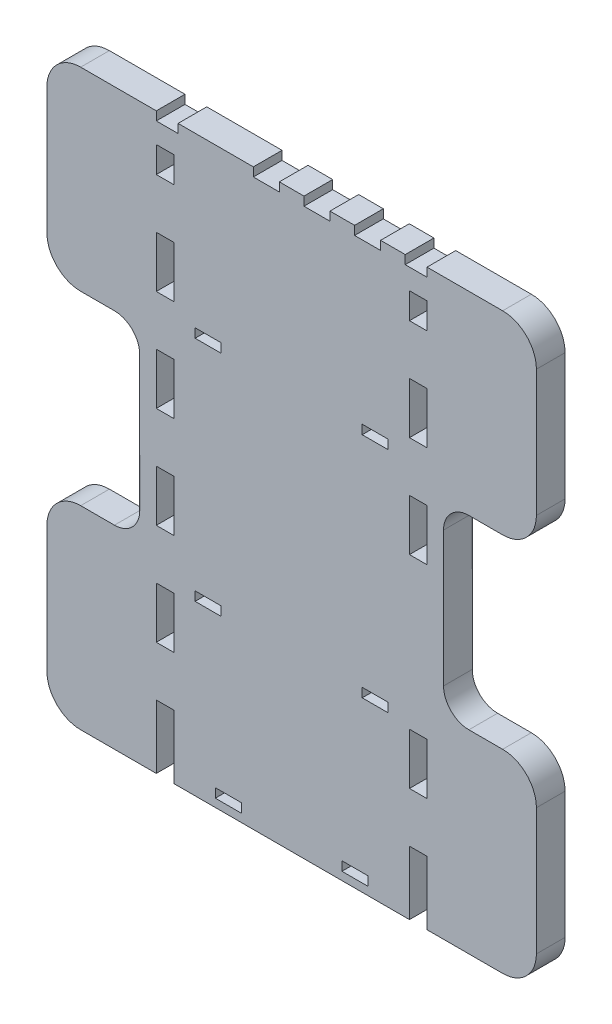
from build123d import *

# Parameters (mm, degrees)
MODEL_W             = 15.4
MODEL_H             = 5.4
MODEL_W_2           = 10.4
MODEL_H_2           = 15.4
MODEL_H_3           = 30.4
BOSS_EXTRUDE1_DEPTH = 17


with BuildPart() as part:
    # Model → Boss-Extrude1 (new body)
    with BuildSketch(Plane.XY):
        with BuildLine():
            Line((-144.178149878, -108.319218198), (-99.378149878, -108.319218198))
            Line((-99.378149878, -108.319218198), (-99.378149878, -70.619218198))
            Line((-99.378149878, -70.619218198), (-88.978149878, -70.619218198))
            Line((-88.978149878, -70.619218198), (-88.978149878, -108.319218198))
            Line((-88.978149878, -108.319218198), (50.621850122, -108.319218198))
            Line((50.621850122, -108.319218198), (50.621850122, -70.619218198))
            Line((50.621850122, -70.619218198), (61.021850122, -70.619218198))
            Line((61.021850122, -70.619218198), (61.021850122, -108.319218198))
            Line((61.021850122, -108.319218198), (105.821850122, -108.319218198))
            ThreePointArc((105.821850122, -108.319218198), (119.963985745, -102.461353822), (125.821850122, -88.319218198))
            Line((125.821850122, -88.319218198), (125.821850122, -13.319218198))
            ThreePointArc((125.821850122, -13.319218198), (119.963985745, 0.822917426), (105.821850122, 6.680781802))
            Line((105.821850122, 6.680781802), (85.821850122, 6.680781802))
            ThreePointArc((85.821850122, 6.680781802), (75.215248404, 11.074180084), (70.821850122, 21.680781802))
            Line((70.821850122, 21.680781802), (70.821850122, 101.680781802))
            ThreePointArc((70.821850122, 101.680781802), (75.215248404, 112.28738352), (85.821850122, 116.680781802))
            Line((85.821850122, 116.680781802), (105.821850122, 116.680781802))
            ThreePointArc((105.821850122, 116.680781802), (119.963985745, 122.538646178), (125.821850122, 136.680781802))
            Line((125.821850122, 136.680781802), (125.821850122, 211.680781802))
            ThreePointArc((125.821850122, 211.680781802), (119.963985745, 225.822917426), (105.821850122, 231.680781802))
            Line((105.821850122, 231.680781802), (61.021850122, 231.680781802))
            Line((61.021850122, 231.680781802), (61.021850122, 226.480781802))
            Line((61.021850122, 226.480781802), (48.121850122, 226.480781802))
            Line((48.121850122, 226.480781802), (48.121850122, 231.680781802))
            Line((48.121850122, 231.680781802), (33.521850122, 231.680781802))
            Line((33.521850122, 231.680781802), (33.521850122, 226.480781802))
            Line((33.521850122, 226.480781802), (18.121850122, 226.480781802))
            Line((18.121850122, 226.480781802), (18.121850122, 231.680781802))
            Line((18.121850122, 231.680781802), (3.521850122, 231.680781802))
            Line((3.521850122, 231.680781802), (3.521850122, 226.480781802))
            Line((3.521850122, 226.480781802), (-11.878149878, 226.480781802))
            Line((-11.878149878, 226.480781802), (-11.878149878, 231.680781802))
            Line((-11.878149878, 231.680781802), (-26.478149878, 231.680781802))
            Line((-26.478149878, 231.680781802), (-26.478149878, 226.480781802))
            Line((-26.478149878, 226.480781802), (-41.878149878, 226.480781802))
            Line((-41.878149878, 226.480781802), (-41.878149878, 231.680781802))
            Line((-41.878149878, 231.680781802), (-86.478149878, 231.680781802))
            Line((-86.478149878, 231.680781802), (-86.478149878, 226.480781802))
            Line((-86.478149878, 226.480781802), (-99.378149878, 226.480781802))
            Line((-99.378149878, 226.480781802), (-99.378149878, 231.680781802))
            Line((-99.378149878, 231.680781802), (-144.178149878, 231.680781802))
            ThreePointArc((-144.178149878, 231.680781802), (-158.320285502, 225.822917426), (-164.178149878, 211.680781802))
            Line((-164.178149878, 211.680781802), (-164.178149878, 136.680781802))
            ThreePointArc((-164.178149878, 136.680781802), (-158.320285502, 122.538646178), (-144.178149878, 116.680781802))
            Line((-144.178149878, 116.680781802), (-124.178149878, 116.680781802))
            ThreePointArc((-124.178149878, 116.680781802), (-113.571548161, 112.28738352), (-109.178149878, 101.680781802))
            Line((-109.178149878, 101.680781802), (-109.178149878, 21.680781802))
            ThreePointArc((-109.178149878, 21.680781802), (-113.571548161, 11.074180084), (-124.178149878, 6.680781802))
            Line((-124.178149878, 6.680781802), (-144.178149878, 6.680781802))
            ThreePointArc((-144.178149878, 6.680781802), (-158.320285502, 0.822917426), (-164.178149878, -13.319218198))
            Line((-164.178149878, -13.319218198), (-164.178149878, -88.319218198))
            ThreePointArc((-164.178149878, -88.319218198), (-158.320285502, -102.461353822), (-144.178149878, -108.319218198))
        make_face()
        with Locations((30.321850122, 129.180781802)):
            Rectangle(MODEL_W, MODEL_H, mode=Mode.SUBTRACT)
        with Locations((-68.678149878, 129.180781802)):
            Rectangle(MODEL_W, MODEL_H, mode=Mode.SUBTRACT)
        with Locations((30.321850122, -5.819218198)):
            Rectangle(MODEL_W, MODEL_H, mode=Mode.SUBTRACT)
        with Locations((-68.678149878, -5.819218198)):
            Rectangle(MODEL_W, MODEL_H, mode=Mode.SUBTRACT)
        with Locations((-94.178149878, 206.680781802)):
            Rectangle(MODEL_W_2, MODEL_H_2, mode=Mode.SUBTRACT)
        with Locations((-94.178149878, -25.819218198)):
            Rectangle(MODEL_W_2, MODEL_H_3, mode=Mode.SUBTRACT)
        with Locations((-94.178149878, 94.180781802)):
            Rectangle(MODEL_W_2, MODEL_H_3, mode=Mode.SUBTRACT)
        with Locations((-94.178149878, 154.180781802)):
            Rectangle(MODEL_W_2, MODEL_H_3, mode=Mode.SUBTRACT)
        with Locations((55.821850122, -25.819218198)):
            Rectangle(MODEL_W_2, MODEL_H_3, mode=Mode.SUBTRACT)
        with Locations((55.821850122, 94.180781802)):
            Rectangle(MODEL_W_2, MODEL_H_3, mode=Mode.SUBTRACT)
        with Locations((55.821850122, 154.180781802)):
            Rectangle(MODEL_W_2, MODEL_H_3, mode=Mode.SUBTRACT)
        with Locations((18.321850122, -100.819218198)):
            Rectangle(MODEL_W, MODEL_H, mode=Mode.SUBTRACT)
        with Locations((-56.678149878, -100.819218198)):
            Rectangle(MODEL_W, MODEL_H, mode=Mode.SUBTRACT)
        with Locations((55.821850122, 206.680781802)):
            Rectangle(MODEL_W_2, MODEL_H_2, mode=Mode.SUBTRACT)
        with Locations((-94.178149878, 34.180781802)):
            Rectangle(MODEL_W_2, MODEL_H_3, mode=Mode.SUBTRACT)
    extrude(amount=BOSS_EXTRUDE1_DEPTH)


solid = part.part
